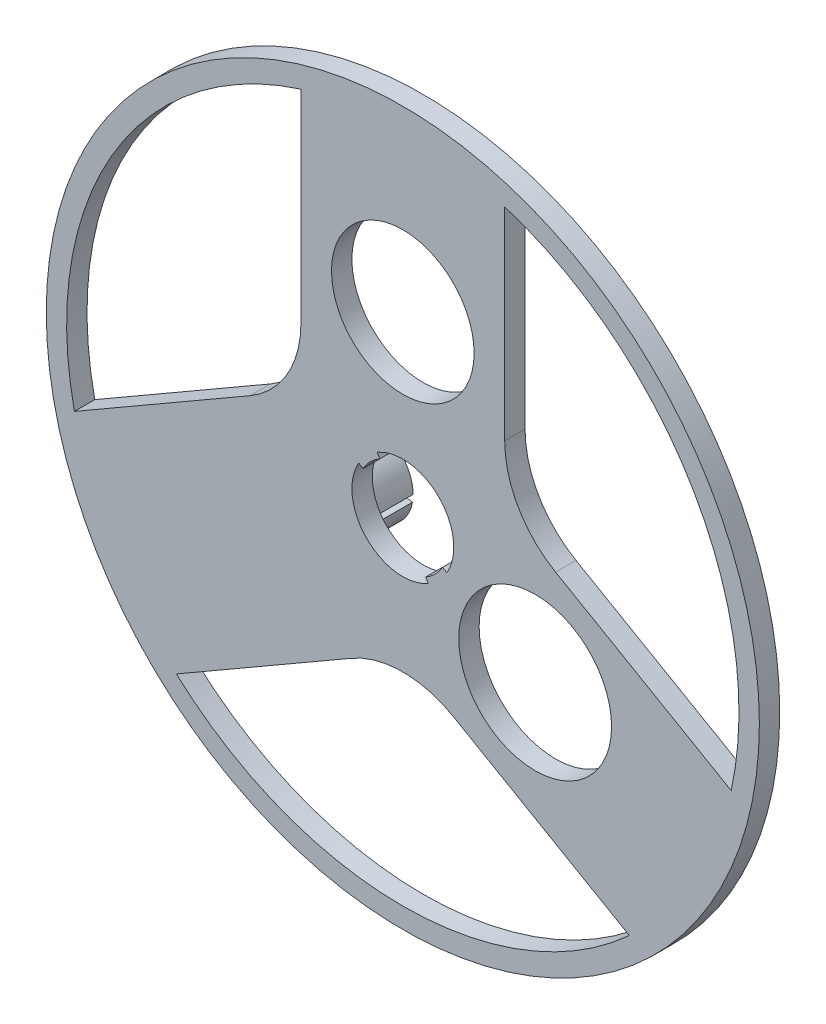
from build123d import *

# Parameters (mm, degrees)
SKETCH1_R           = 35
BOSS_EXTRUDE1_DEPTH = 2
FILLET1_R           = 10
CUT_EXTRUDE2_REACH  = 51.538
CUT_EXTRUDE3_REACH  = 51.538
SKETCH3_R           = 7
SKETCH3_R_2         = 7.5
BOSS_EXTRUDE2_DEPTH = 8


with BuildPart() as part:
    # Sketch1 → Boss-Extrude1 (new body)
    with BuildSketch(Plane.XY):
        Circle(SKETCH1_R)
        with BuildLine():
            Line((-10, 31.448370387), (-10, 5.773502692))
            Line((-10, 5.773502692), (-32.235087663, -7.063931156))
            ThreePointArc((-32.235087663, -7.063931156), (-28.578838325, 16.5), (-10, 31.448370387))
        make_face(mode=Mode.SUBTRACT)
        with BuildLine():
            Line((-22.235087663, -24.384439231), (0, -11.547005384))
            Line((0, -11.547005384), (22.235087663, -24.384439231))
            ThreePointArc((22.235087663, -24.384439231), (0, -33), (-22.235087663, -24.384439231))
        make_face(mode=Mode.SUBTRACT)
        with BuildLine():
            ThreePointArc((10, 31.448370387), (28.578838325, 16.5), (32.235087663, -7.063931156))
            Line((32.235087663, -7.063931156), (10, 5.773502692))
            Line((10, 5.773502692), (10, 31.448370387))
        make_face(mode=Mode.SUBTRACT)
    extrude(amount=BOSS_EXTRUDE1_DEPTH)

    # Fillet1
    fillet1_edges = [part.edges().sort_by_distance(p)[0] for p in [
        (10, 5.773502692, 1),
        (0, -11.547005384, 1),
        (-10, 5.773502692, 1),
    ]]
    fillet(fillet1_edges, radius=FILLET1_R)

    # Sketch2 → Cut-Extrude2 (cut, up to next)
    with BuildSketch(Plane(origin=(0, 0, 0), x_dir=(-1, 0, 0), z_dir=(0, 0, -1)), mode=Mode.PRIVATE) as cut_extrude2_sk1:
        with BuildLine():
            Line((2.25, 3.897114317), (2.5, 4.330127019))
            ThreePointArc((2.5, 4.330127019), (-3.535533906, 3.535533906), (-4.330127019, -2.5))
            Line((-4.330127019, -2.5), (-3.897114317, -2.25))
            ThreePointArc((-3.897114317, -2.25), (-3.181980515, -3.181980515), (-2.25, -3.897114317))
            Line((-2.25, -3.897114317), (-2.5, -4.330127019))
            ThreePointArc((-2.5, -4.330127019), (3.535533906, -3.535533906), (4.330127019, 2.5))
            Line((4.330127019, 2.5), (3.897114317, 2.25))
            ThreePointArc((3.897114317, 2.25), (3.181980515, 3.181980515), (2.25, 3.897114317))
        make_face()
    cut_extrude2_tool1 = extrude(cut_extrude2_sk1.sketch, amount=-CUT_EXTRUDE2_REACH, mode=Mode.PRIVATE) & part.part
    add(cut_extrude2_tool1.solids().sort_by_distance((0, 0, 0))[0], mode=Mode.SUBTRACT)

    # Sketch3 → Cut-Extrude3 (cut, up to next)
    with BuildSketch(Plane(origin=(0, 0, 0), x_dir=(-1, 0, 0), z_dir=(0, 0, -1)), mode=Mode.PRIVATE) as cut_extrude3_sk1:
        with Locations((0, 17.5)):
            Circle(SKETCH3_R)
    cut_extrude3_tool1 = extrude(cut_extrude3_sk1.sketch, amount=-CUT_EXTRUDE3_REACH, mode=Mode.PRIVATE) & part.part
    # Sketch3 → Cut-Extrude3 (cut, up to next)
    with BuildSketch(Plane(origin=(0, 0, 0), x_dir=(-1, 0, 0), z_dir=(0, 0, -1)), mode=Mode.PRIVATE) as cut_extrude3_sk2:
        with Locations((-12.990381057, -7.5)):
            Circle(SKETCH3_R_2)
    cut_extrude3_tool2 = extrude(cut_extrude3_sk2.sketch, amount=-CUT_EXTRUDE3_REACH, mode=Mode.PRIVATE) & part.part
    add(cut_extrude3_tool1.solids().sort_by_distance((0, 17.5, 0))[0], mode=Mode.SUBTRACT)
    add(cut_extrude3_tool2.solids().sort_by_distance((12.990381, -7.5, 0))[0], mode=Mode.SUBTRACT)

    # Sketch3<4> → Boss-Extrude2 (add)
    with BuildSketch(Plane(origin=(0, 0, 0), x_dir=(-1, 0, 0), z_dir=(0, 0, -1))):
        with BuildLine():
            Line((12.990381057, -3.5), (12.990381057, -4.1))
            ThreePointArc((12.990381057, -4.1), (15.17585893, -4.895448893), (16.338727417, -6.909596196))
            Line((16.338727417, -6.909596196), (16.929612069, -6.805407289))
            ThreePointArc((16.929612069, -6.805407289), (15.561531496, -4.435822228), (12.990381057, -3.5))
        make_face()
        with BuildLine():
            ThreePointArc((16.390381057, -7.5), (15.594932163, -9.685477873), (13.580784861, -10.84834636))
            Line((13.580784861, -10.84834636), (13.684973767, -11.439231012))
            ThreePointArc((13.684973767, -11.439231012), (16.054558829, -10.071150439), (16.990381057, -7.5))
            Line((16.990381057, -7.5), (16.390381057, -7.5))
        make_face()
        with BuildLine():
            ThreePointArc((12.990381057, -10.9), (10.804903184, -10.104551107), (9.642034697, -8.090403804))
            Line((9.642034697, -8.090403804), (9.051150045, -8.194592711))
            ThreePointArc((9.051150045, -8.194592711), (10.419230618, -10.564177772), (12.990381057, -11.5))
            Line((12.990381057, -11.5), (12.990381057, -10.9))
        make_face()
        with BuildLine():
            ThreePointArc((9.590381057, -7.5), (10.38582995, -5.314522127), (12.399977253, -4.15165364))
            Line((12.399977253, -4.15165364), (12.295788346, -3.560768988))
            ThreePointArc((12.295788346, -3.560768988), (9.926203284, -4.928849561), (8.990381057, -7.5))
            Line((8.990381057, -7.5), (9.590381057, -7.5))
        make_face()
    extrude(amount=BOSS_EXTRUDE2_DEPTH)


solid = part.part
